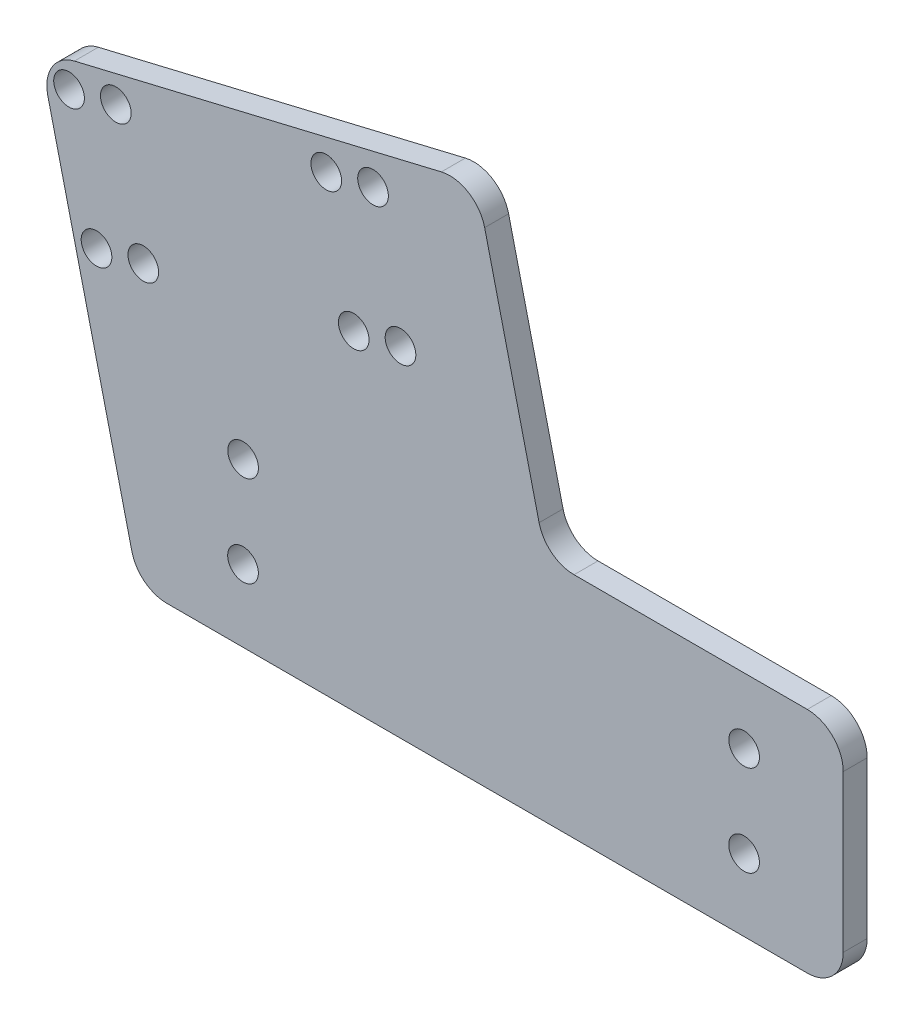
from build123d import *

# Parameters (mm, degrees)
SKETCH1_R           = 2.032
SKETCH1_RX          = 2.032
SKETCH1_RY          = 2.031999502
BOSS_EXTRUDE1_DEPTH = 3.175
FILLET1_R           = 4.7625


with BuildPart() as part:
    # Sketch1 → Boss-Extrude1 (new body)
    with BuildSketch(Plane.XY):
        Polygon((-40.530490432, 38.563534157), (17.380628715, 52.371523419), (26.574151776, 13.813613269), (66.017725223, 13.813613269), (66.017725223, -16.462333503), (-27.410443695, -16.462333503), align=None)
        with Locations((-36.609618565, 36.052645813)):
            Circle(SKETCH1_R, mode=Mode.SUBTRACT)
        with Locations((-30.41013892, 37.427037361)):
            Circle(SKETCH1_R, mode=Mode.SUBTRACT)
        with Locations((-32.967480962, 19.624024753)):
            Circle(SKETCH1_R, mode=Mode.SUBTRACT)
        with Locations((52.87506012, -6.929134334)):
            Circle(SKETCH1_R, mode=Mode.SUBTRACT)
        with Locations((-13.545923607, -6.929134334)):
            Circle(SKETCH1_R, mode=Mode.SUBTRACT)
        with Locations(Location((52.883061118, 5.135865666), (0, 0, 90))):
            Ellipse(SKETCH1_RX, SKETCH1_RY, mode=Mode.SUBTRACT)
        with Locations(Location((-13.537922609, 5.135865666), (0, 0, 90))):
            Ellipse(SKETCH1_RX, SKETCH1_RY, mode=Mode.SUBTRACT)
        with BuildLine():
            ThreePointArc((9.01240199, 27.419307073), (9.31297022, 28.997375114), (8.37364252, 30.300564844))
            ThreePointArc((8.37364252, 30.300564844), (5.345303247, 28.117764523), (9.01240199, 27.419307073))
        make_face(mode=Mode.SUBTRACT)
        with BuildLine():
            ThreePointArc((5.370264386, 43.847928133), (5.670832616, 45.425996173), (4.731504917, 46.729185904))
            ThreePointArc((4.731504917, 46.729185904), (1.703165643, 44.546385582), (5.370264386, 43.847928133))
        make_face(mode=Mode.SUBTRACT)
        with BuildLine():
            ThreePointArc((-3.556986303, 41.868804303), (-0.528647029, 44.051604625), (-4.195745772, 44.750062074))
            ThreePointArc((-4.195745772, 44.750062074), (-4.496314002, 43.171994034), (-3.556986303, 41.868804303))
        make_face(mode=Mode.SUBTRACT)
        with BuildLine():
            ThreePointArc((0.085151301, 25.440183244), (3.113490574, 27.622983565), (-0.553608169, 28.321441014))
            ThreePointArc((-0.553608169, 28.321441014), (-0.854176399, 26.743372974), (0.085151301, 25.440183244))
        make_face(mode=Mode.SUBTRACT)
        with BuildLine():
            ThreePointArc((-25.08473606, 19.860153557), (-24.78416783, 21.438221597), (-25.723495529, 22.741411327))
            ThreePointArc((-25.723495529, 22.741411327), (-28.751834803, 20.558611006), (-25.08473606, 19.860153557))
        make_face(mode=Mode.SUBTRACT)
    extrude(amount=BOSS_EXTRUDE1_DEPTH)

    # Fillet1
    fillet1_edges = [part.edges().sort_by_distance(p)[0] for p in [
        (-40.530490432, 38.563534157, 1.5875),
        (17.380628715, 52.371523419, 1.5875),
        (26.574151776, 13.813613269, 1.5875),
        (66.017725223, 13.813613269, 1.5875),
        (66.017725223, -16.462333503, 1.5875),
        (-27.410443695, -16.462333503, 1.5875),
    ]]
    fillet(fillet1_edges, radius=FILLET1_R)


solid = part.part
